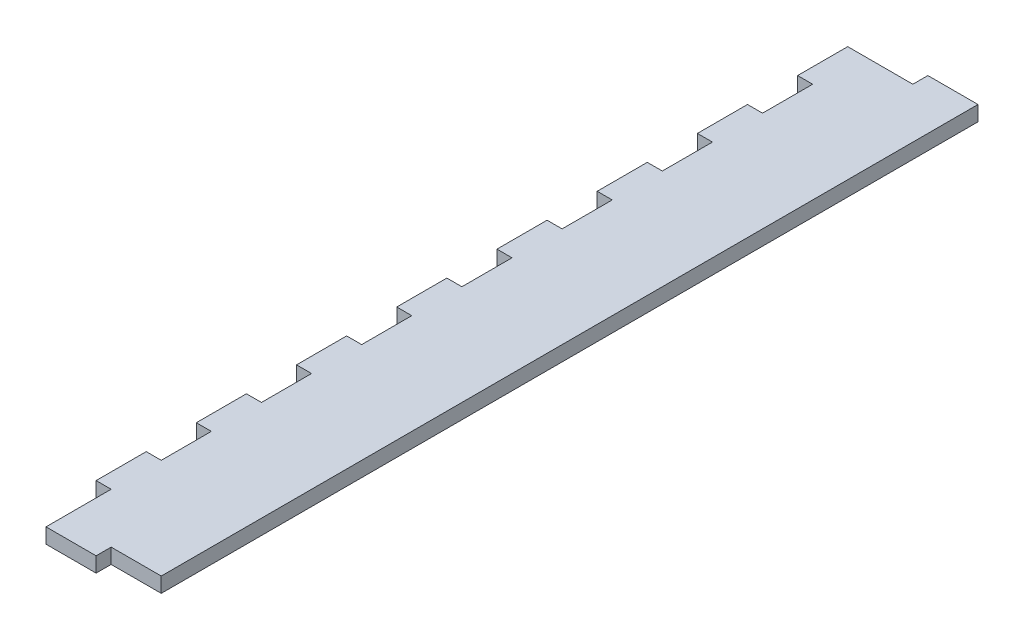
from build123d import *

# Parameters (mm, degrees)
BOSS_EXTRUDE1_DEPTH = 3
SKETCH2_W           = 79.051219732
SKETCH2_H           = 181.686841404
CUT_EXTRUDE1_DEPTH  = 94.52539762


with BuildPart() as part:
    # Sketch1 → Boss-Extrude1 (new body)
    with BuildSketch(Plane(origin=(0, 0, 0), x_dir=(1, 0, 0), z_dir=(0, 1, 0))):
        Polygon((40, 80), (40, 70), (43, 70), (43, 60), (40, 60), (40, 50), (43, 50), (43, 40), (40, 40), (40, 30), (43, 30), (43, 20), (40, 20), (40, 10), (43, 10), (43, 0), (40, 0), (40, -10), (43, -10), (43, -20), (40, -20), (40, -30), (43, -30), (43, -40), (40, -40), (40, -50), (43, -50), (43, -60), (40, -60), (40, -70), (43, -70), (43, -80), (40, -80), (30, -80), (30, -83), (20, -83), (20, -80), (10, -80), (10, -83), (0, -83), (0, -80), (-10, -80), (-10, -83), (-20, -83), (-20, -80), (-30, -80), (-30, -83), (-40, -83), (-40, -80), (-40, -70), (-43, -70), (-43, -60), (-40, -60), (-40, -50), (-43, -50), (-43, -40), (-40, -40), (-40, -30), (-43, -30), (-43, -20), (-40, -20), (-40, -10), (-43, -10), (-43, 0), (-40, 0), (-40, 10), (-43, 10), (-43, 20), (-40, 20), (-40, 30), (-43, 30), (-43, 40), (-40, 40), (-40, 50), (-43, 50), (-43, 60), (-40, 60), (-40, 70), (-43, 70), (-43, 80), (-40, 80), (-30, 80), (-30, 83), (-20, 83), (-20, 80), (-10, 80), (-10, 83), (0, 83), (0, 80), (10, 80), (10, 83), (20, 83), (20, 80), (30, 80), (30, 83), (40, 83), align=None)
    extrude(amount=BOSS_EXTRUDE1_DEPTH)

    # Sketch2 → Cut-Extrude1 (cut, through all)
    with BuildSketch(Plane(origin=(0, 3, 0), x_dir=(1, 0, 0), z_dir=(0, 1, 0))):
        with Locations((19.525609866, -1.45411583)):
            Rectangle(SKETCH2_W, SKETCH2_H)
    extrude(amount=-CUT_EXTRUDE1_DEPTH, mode=Mode.SUBTRACT)


solid = part.part
